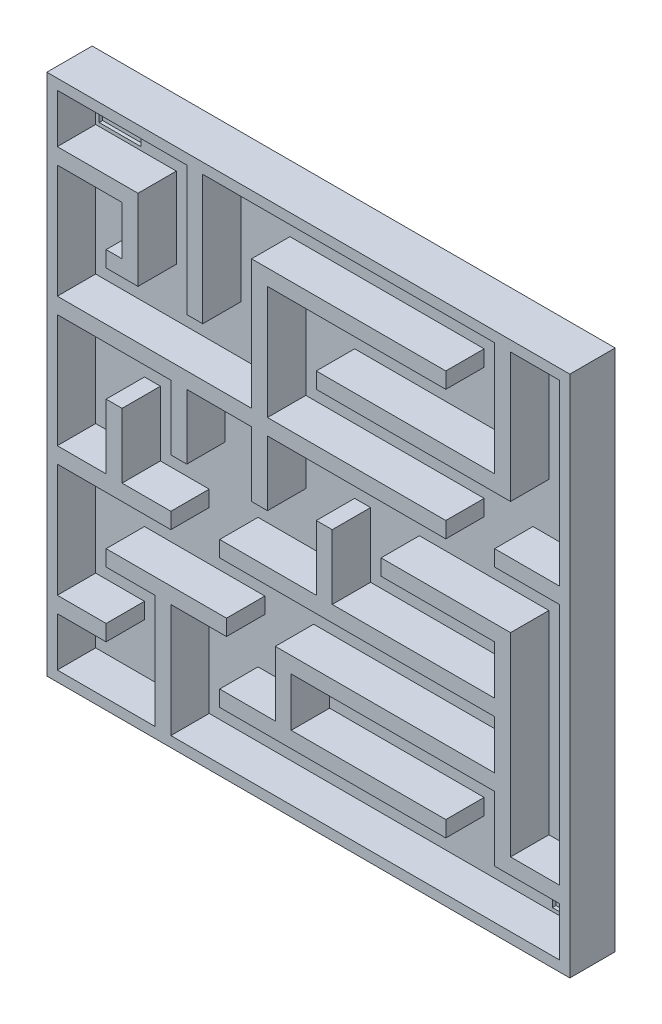
from build123d import *

# Parameters (mm, degrees)
SKETCH2_W           = 150
SKETCH2_H           = 150
BOSS_EXTRUDE1_DEPTH = 2
SKETCH3_W           = 150
SKETCH3_H           = 150
BOSS_EXTRUDE2_DEPTH = 11
SKETCH4_W           = 12
SKETCH4_H           = 12
CUT_EXTRUDE1_DEPTH  = 1


with BuildPart() as part:
    # Sketch2 → Boss-Extrude1 (new body)
    with BuildSketch(Plane.XY):
        with Locations((75, -75)):
            Rectangle(SKETCH2_W, SKETCH2_H)
    extrude(amount=BOSS_EXTRUDE1_DEPTH)

    # Sketch3 → Boss-Extrude2 (add)
    with BuildSketch(Plane.XY.offset(2)):
        with Locations((75, -75)):
            Rectangle(SKETCH3_W, SKETCH3_H)
        Polygon((147, -147), (35.571428571, -147), (35.571428571, -114.428571429), (51.525296988, -114.428571429), (51.525296988, -109.857142857), (17, -109.857142857), (17, -114.428571429), (31, -114.428571429), (31, -147), (3, -147), (3, -133), (17, -133), (17, -128.428571429), (3, -128.428571429), (3, -95.857142857), (35.571428571, -95.857142857), (35.571428571, -91.285714286), (21.571428571, -91.285714286), (21.571428571, -72.714285714), (17, -72.714285714), (17, -91.285714286), (3, -91.285714286), (3, -58.714285714), (35.571428571, -58.714285714), (35.571428571, -77.285714286), (40.142857143, -77.285714286), (40.142857143, -58.714285714), (58.714285714, -58.714285714), (58.714285714, -77.285714286), (63.285714286, -77.285714286), (63.285714286, -58.714285714), (114.428571429, -58.714285714), (114.428571429, -54.142857143), (63.285714286, -54.142857143), (63.285714286, -21.571428571), (114.428571429, -21.571428571), (114.428571429, -17), (58.714285714, -17), (58.714285714, -54.142857143), (3, -54.142857143), (3, -21.571428571), (21.571428571, -21.571428571), (21.571428571, -35.571428571), (17, -35.571428571), (17, -40.142857143), (26.142857143, -40.142857143), (26.142857143, -17), (3, -17), (3, -3), (40.142857143, -3), (40.142857143, -40.142857143), (44.714285714, -40.142857143), (44.714285714, -3), (128.428571429, -3), (128.428571429, -35.571428571), (77.285714286, -35.571428571), (77.285714286, -40.142857143), (133, -40.142857143), (133, -3), (147, -3), (147, -54.142857143), (128.428571429, -54.142857143), (128.428571429, -58.714285714), (147, -58.714285714), (147, -128.428571429), (133, -128.428571429), (133, -72.714285714), (95.857142857, -72.714285714), (95.857142857, -77.285714286), (128.428571429, -77.285714286), (128.428571429, -91.285714286), (81.857142857, -91.285714286), (81.857142857, -72.714285714), (77.285714286, -72.714285714), (77.285714286, -91.285714286), (49.571428571, -91.285714286), (49.571428571, -95.857142857), (128.428571429, -95.857142857), (128.428571429, -109.857142857), (65.525296988, -109.857142857), (65.525296988, -128.428571429), (49.571428571, -128.428571429), (49.571428571, -133), (114.428571429, -133), (114.428571429, -128.428571429), (70.09672556, -128.428571429), (70.09672556, -114.428571429), (128.428571429, -114.428571429), (128.428571429, -133), (147, -133), align=None, mode=Mode.SUBTRACT)
    extrude(amount=BOSS_EXTRUDE2_DEPTH)

    # Sketch4 → Cut-Extrude1 (cut)
    with BuildSketch(Plane.XY.offset(2)):
        with Locations((10, -10)):
            Rectangle(SKETCH4_W, SKETCH4_H)
        with Locations((140, -140)):
            Rectangle(SKETCH4_W, SKETCH4_H)
    extrude(amount=-CUT_EXTRUDE1_DEPTH, mode=Mode.SUBTRACT)


solid = part.part
